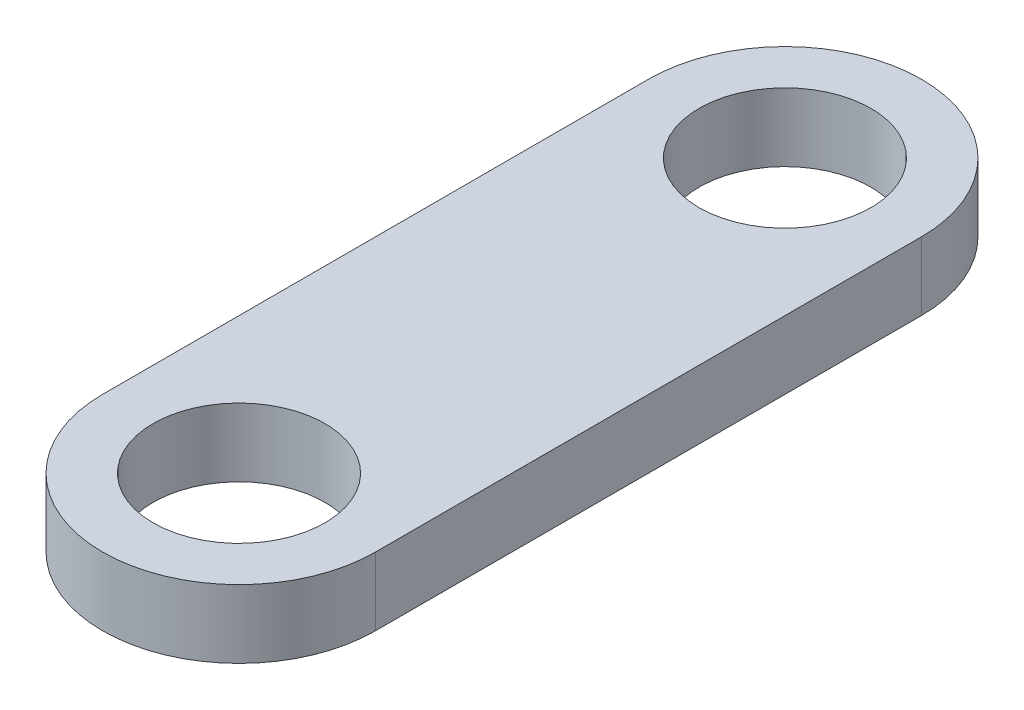
from build123d import *

# Parameters (mm, degrees)
SKETCH2_R           = 2
BOSS_EXTRUDE1_DEPTH = 1.5875


with BuildPart() as part:
    # Sketch2 → Boss-Extrude1 (new body)
    with BuildSketch(Plane(origin=(0, 0, 0), x_dir=(1, 0, 0), z_dir=(0, 1, 0))):
        with BuildLine():
            Line((3.175, 0), (3.175, -12.7))
            ThreePointArc((3.175, -12.7), (0, -15.875), (-3.175, -12.7))
            Line((-3.175, -12.7), (-3.175, 0))
            ThreePointArc((-3.175, 0), (0, 3.175), (3.175, 0))
        make_face()
        with Locations(Location((0, 0, 0), (0, 0, 270))):
            Circle(SKETCH2_R, mode=Mode.SUBTRACT)
        with Locations(Location((0, -12.7, 0), (0, 0, 270))):
            Circle(SKETCH2_R, mode=Mode.SUBTRACT)
    extrude(amount=BOSS_EXTRUDE1_DEPTH)


solid = part.part
